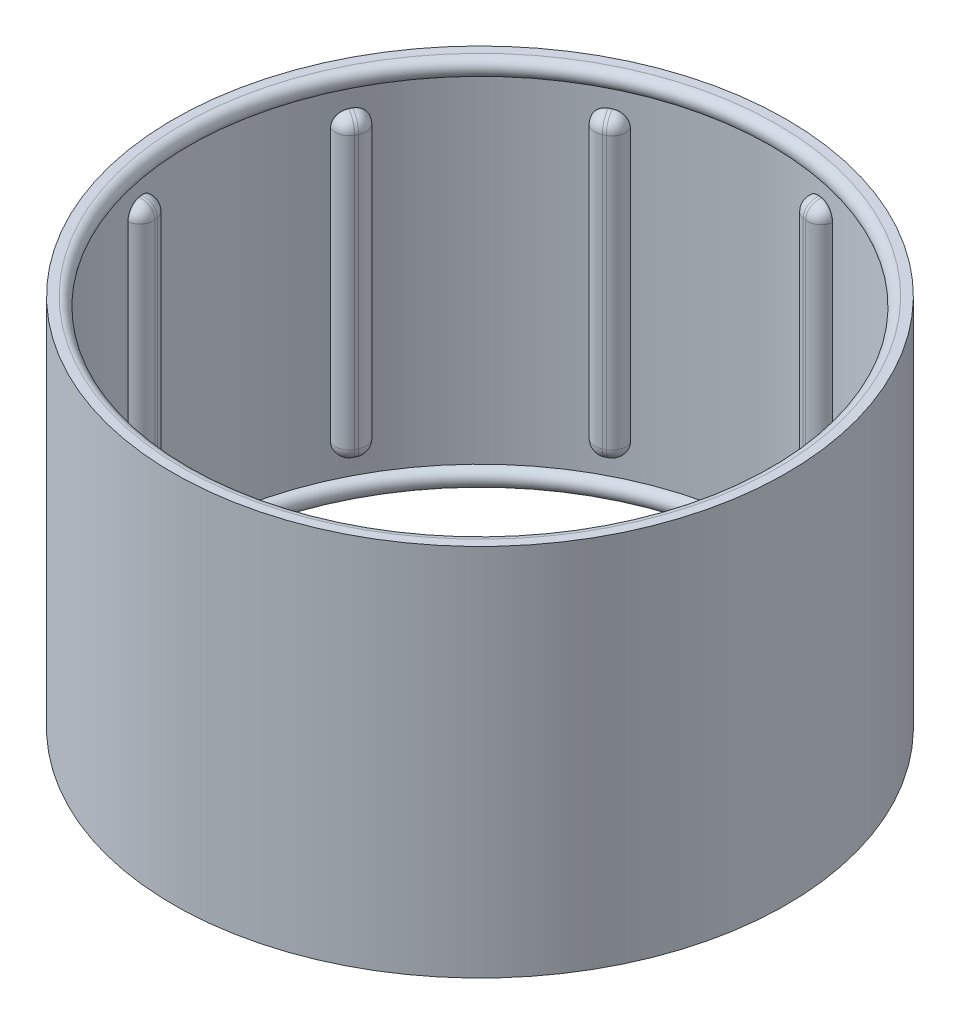
from build123d import *

# Parameters (mm, degrees)
SKETCH3_W                = 1.524
SKETCH3_H                = 63.5
SKETCH12_W               = 5.08
SKETCH12_H               = 50.8
BOSS_EXTRUDE1_DEPTH      = 2.54
FILLET1_R                = 2.286
CIRPATTERN1_COUNT        = 10
FILLET1_OF_CIRPATTERN1_R = 2.286


with BuildPart() as part:
    # Sketch3 → Revolve6 (revolve)
    with BuildSketch(Plane.XY, mode=Mode.PRIVATE) as revolve6_sk:
        with Locations((-51.308, 0)):
            Rectangle(SKETCH3_W, SKETCH3_H)
        with BuildLine():
            ThreePointArc((-50.546, 28.702), (-49.022, 30.226), (-50.546, 31.75))
            Line((-50.546, 31.75), (-50.546, 28.702))
        make_face()
        with BuildLine():
            Line((-50.546, -28.702), (-50.546, -31.75))
            ThreePointArc((-50.546, -31.75), (-49.022, -30.226), (-50.546, -28.702))
        make_face()
    revolve(revolve6_sk.sketch.rotate(Axis((0, 0, 0), (0, 1, 0)), 270), axis=Axis((0, 0, 0), (0, 1, 0)))

    # Sketch12 → Boss-Extrude1 (add)
    with BuildSketch(Plane(origin=(35.836275549, 0, -35.836275549), x_dir=(0.7071067811865477, 0, 0.7071067811865475), z_dir=(-0.7071067811865475, 0, 0.7071067811865477))):
        with Locations((0.072383293, 0)):
            Rectangle(SKETCH12_W, SKETCH12_H)
    boss_extrude1 = extrude(amount=BOSS_EXTRUDE1_DEPTH)

    # Fillet1
    fillet1_edges = [part.edges().sort_by_distance(p)[0] for p in [
        (36.714172045, 25.4, -33.019704162),
        (33.124644849, -25.4, -36.614381863),
        (36.714172045, -25.4, -33.019704162),
        (33.124644849, 25.4, -36.614381863),
        (35.887458266, 0, -32.192990383),
        (34.091407042, 25.4, -33.989041607),
        (32.295355818, 0, -35.785092831),
        (34.091407042, -25.4, -33.989041607),
    ]]
    fillet(fillet1_edges, radius=FILLET1_R)

    # CirPattern1: Boss-Extrude1 ×10 about axis
    cirpattern1_axis = Axis((0, 0, 0), (0, 1, 0))
    for i in range(1, CIRPATTERN1_COUNT):
        add(boss_extrude1.rotate(cirpattern1_axis, i * 360 / CIRPATTERN1_COUNT))

    # Fillet1 of CirPattern1
    fillet1_of_cirpattern1_edges = [part.edges().sort_by_distance(p)[0] for p in [
        (10.293893978, 25.4, -48.293550695),
        (5.277006935, -25.4, -49.091834895),
        (10.293893978, -25.4, -48.293550695),
        (5.277006935, 25.4, -49.091834895),
        (10.110998648, 0, -47.13879503),
        (7.602270263, 25.4, -47.536138572),
        (5.093541878, 0, -47.933482113),
        (7.602270263, -25.4, -47.536138572),
        (-20.058301713, 25.4, -45.1209023),
        (-24.58626827, -25.4, -42.817875568),
        (-20.058301713, -25.4, -45.1209023),
        (-24.58626827, 25.4, -42.817875568),
        (-19.527518793, 0, -44.079182165),
        (-21.790675365, 25.4, -42.926046296),
        (-24.053831936, 0, -41.772910426),
        (-21.790675365, -25.4, -42.926046296),
        (-42.748907906, 25.4, -24.713602829),
        (-45.058424652, -25.4, -20.1889431),
        (-42.748907906, -25.4, -24.713602829),
        (-45.058424652, 25.4, -20.1889431),
        (-41.707187772, 0, -24.182819909),
        (-42.860323641, 25.4, -21.919663338),
        (-44.01345951, 0, -19.656506766),
        (-42.860323641, -25.4, -21.919663338),
        (-49.110884261, 25.4, 5.133452938),
        (-48.319794296, -25.4, 10.151479436),
        (-49.110884261, -25.4, 5.133452938),
        (-48.319794296, 25.4, 10.151479436),
        (-47.956128596, 0, 4.950557608),
        (-47.558785055, 25.4, 7.459285993),
        (-47.161441514, 0, 9.968014379),
        (-47.558785055, -25.4, 7.459285993),
        (-36.714172045, 25.4, 33.019704162),
        (-33.124644849, -25.4, 36.614381863),
        (-36.714172045, -25.4, 33.019704162),
        (-33.124644849, 25.4, 36.614381863),
        (-35.887458266, 0, 32.192990383),
        (-34.091407042, 25.4, 33.989041607),
        (-32.295355818, 0, 35.785092831),
        (-34.091407042, -25.4, 33.989041607),
        (-10.293893978, 25.4, 48.293550695),
        (-5.277006935, -25.4, 49.091834895),
        (-10.293893978, -25.4, 48.293550695),
        (-5.277006935, 25.4, 49.091834895),
        (-10.110998648, 0, 47.13879503),
        (-7.602270263, 25.4, 47.536138572),
        (-5.093541878, 0, 47.933482113),
        (-7.602270263, -25.4, 47.536138572),
        (20.058301713, 25.4, 45.1209023),
        (24.58626827, -25.4, 42.817875568),
        (20.058301713, -25.4, 45.1209023),
        (24.58626827, 25.4, 42.817875568),
        (19.527518793, 0, 44.079182165),
        (21.790675365, 25.4, 42.926046296),
        (24.053831936, 0, 41.772910426),
        (21.790675365, -25.4, 42.926046296),
        (42.748907906, 25.4, 24.713602829),
        (45.058424652, -25.4, 20.1889431),
        (42.748907906, -25.4, 24.713602829),
        (45.058424652, 25.4, 20.1889431),
        (41.707187772, 0, 24.182819909),
        (42.860323641, 25.4, 21.919663338),
        (44.01345951, 0, 19.656506766),
        (42.860323641, -25.4, 21.919663338),
        (49.110884261, 25.4, -5.133452938),
        (48.319794296, -25.4, -10.151479436),
        (49.110884261, -25.4, -5.133452938),
        (48.319794296, 25.4, -10.151479436),
        (47.956128596, 0, -4.950557608),
        (47.558785055, 25.4, -7.459285993),
        (47.161441514, 0, -9.968014379),
        (47.558785055, -25.4, -7.459285993),
    ]]
    fillet(fillet1_of_cirpattern1_edges, radius=FILLET1_OF_CIRPATTERN1_R)


solid = part.part
